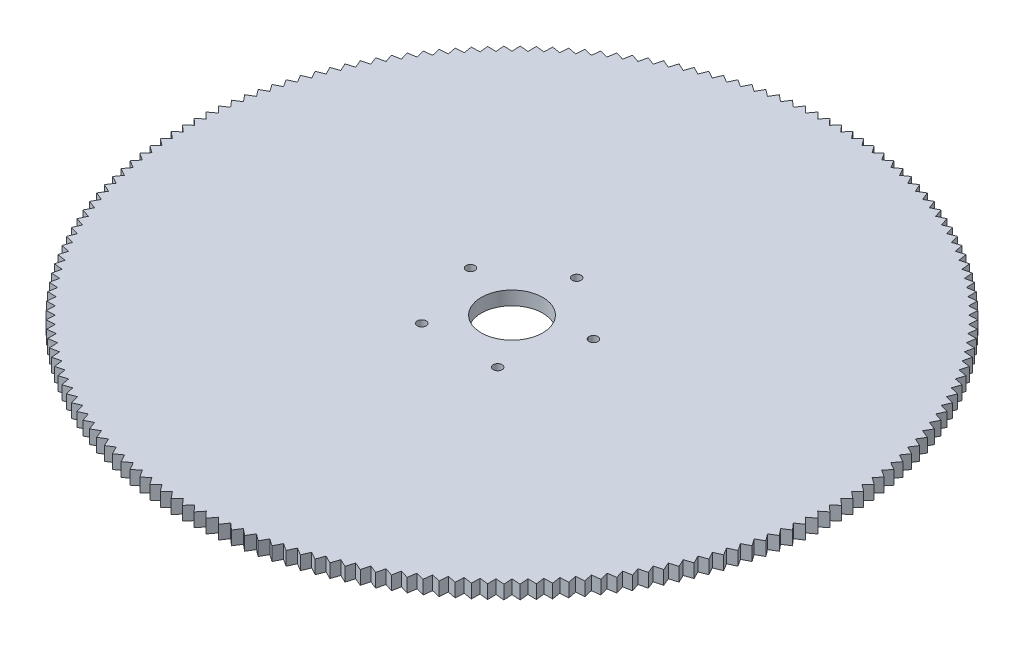
from build123d import *

# Parameters (mm, degrees)
SKETCH1_R           = 14.27
SKETCH1_R_2         = 2.05
BOSS_EXTRUDE1_DEPTH = 6.35


with BuildPart() as part:
    # Sketch1 → Boss-Extrude1 (new body)
    with BuildSketch(Plane(origin=(0, 0, 0), x_dir=(1, 0, 0), z_dir=(0, 1, 0))):
        Polygon((5.339622995, 152.906796534), (2.617860966, 149.977154273), (0, 153), (-2.617860966, 149.977154273), (-5.339622995, 152.906796534), (-7.850393436, 149.794430213), (-10.672740483, 152.62729969), (-13.073361412, 149.429204714), (-15.99285488, 152.161849991), (-18.280401511, 148.881922746), (-21.293484447, 151.511014517), (-23.465169756, 148.153251089), (-26.568171183, 150.675586211), (-28.621349306, 147.244077517), (-31.810488695, 149.656582912), (-33.742658152, 146.155509718), (-37.014050027, 148.45524612), (-38.822856765, 144.888873943), (-42.17251544, 147.073039479), (-43.855755708, 143.445713394), (-47.279600139, 145.511646993), (-48.835223169, 141.82778634), (-52.329081929, 143.77297098), (-53.755192432, 140.037063975), (-57.314808793, 141.859129749), (-58.609669273, 138.075728018), (-62.230706391, 139.772455019), (-63.392739261, 135.946168056), (-67.070785459, 137.515489084), (-68.098574961, 133.650978628), (-71.829149106, 135.090981707), (-72.721443037, 131.192956071), (-76.5, 132.501886779), (-77.255711237, 128.575095105), (-81.077647428, 129.751358712), (-81.695855252, 125.800585192), (-85.556514231, 126.842748601), (-86.036465453, 122.872806643), (-89.931143601, 123.779600139), (-90.272253473, 119.795326507), (-94.196205725, 120.565645302), (-94.398058657, 116.571894219), (-98.346504282, 117.204799797), (-98.408854349, 113.206437033), (-102.376982773, 113.701158298), (-102.299754009, 109.703055243), (-106.28273068, 110.058989452), (-106.066017178, 106.066017178), (-110.058989452, 106.28273068), (-109.703055243, 102.299754009), (-113.701158298, 102.376982773), (-113.206437033, 98.408854349), (-117.204799797, 98.346504282), (-116.571894219, 94.398058657), (-120.565645302, 94.196205725), (-119.795326507, 90.272253473), (-123.779600139, 89.931143601), (-122.872806643, 86.036465453), (-126.842748601, 85.556514231), (-125.800585192, 81.695855252), (-129.751358712, 81.077647428), (-128.575095105, 77.255711237), (-132.501886779, 76.5), (-131.192956071, 72.721443037), (-135.090981707, 71.829149106), (-133.650978628, 68.098574961), (-137.515489084, 67.070785459), (-135.946168055, 63.392739261), (-139.772455019, 62.230706391), (-138.075728018, 58.609669273), (-141.859129749, 57.314808793), (-140.037063975, 53.755192432), (-143.77297098, 52.329081929), (-141.82778634, 48.835223169), (-145.511646993, 47.279600139), (-143.445713394, 43.855755708), (-147.073039479, 42.17251544), (-144.888873943, 38.822856765), (-148.45524612, 37.014050027), (-146.155509718, 33.742658152), (-149.656582912, 31.810488695), (-147.244077517, 28.621349306), (-150.675586211, 26.568171183), (-148.153251089, 23.465169756), (-151.511014517, 21.293484447), (-148.881922746, 18.280401511), (-152.161849991, 15.99285488), (-149.429204714, 13.073361412), (-152.62729969, 10.672740483), (-149.794430213, 7.850393436), (-152.906796534, 5.339622995), (-149.977154273, 2.617860966), (-153, 0), (-149.977154273, -2.617860966), (-152.906796534, -5.339622995), (-149.794430213, -7.850393436), (-152.62729969, -10.672740483), (-149.429204714, -13.073361412), (-152.161849991, -15.99285488), (-148.881922746, -18.280401511), (-151.511014517, -21.293484447), (-148.153251089, -23.465169756), (-150.675586211, -26.568171183), (-147.244077517, -28.621349306), (-149.656582912, -31.810488695), (-146.155509718, -33.742658152), (-148.45524612, -37.014050027), (-144.888873943, -38.822856765), (-147.073039479, -42.17251544), (-143.445713394, -43.855755708), (-145.511646993, -47.279600139), (-141.82778634, -48.835223169), (-143.77297098, -52.329081929), (-140.037063975, -53.755192432), (-141.859129749, -57.314808793), (-138.075728018, -58.609669273), (-139.772455019, -62.230706391), (-135.946168055, -63.392739261), (-137.515489084, -67.070785459), (-133.650978628, -68.098574961), (-135.090981707, -71.829149106), (-131.192956071, -72.721443037), (-132.501886779, -76.5), (-128.575095105, -77.255711237), (-129.751358712, -81.077647428), (-125.800585192, -81.695855252), (-126.842748601, -85.556514231), (-122.872806643, -86.036465453), (-123.779600139, -89.931143601), (-119.795326507, -90.272253473), (-120.565645302, -94.196205725), (-116.571894219, -94.398058657), (-117.204799797, -98.346504282), (-113.206437033, -98.408854349), (-113.701158298, -102.376982773), (-109.703055243, -102.299754009), (-110.058989452, -106.28273068), (-106.066017178, -106.066017178), (-106.28273068, -110.058989452), (-102.299754009, -109.703055243), (-102.376982773, -113.701158298), (-98.408854349, -113.206437033), (-98.346504282, -117.204799797), (-94.398058657, -116.571894219), (-94.196205725, -120.565645302), (-90.272253473, -119.795326507), (-89.931143601, -123.779600139), (-86.036465453, -122.872806643), (-85.556514231, -126.842748601), (-81.695855252, -125.800585192), (-81.077647428, -129.751358712), (-77.255711237, -128.575095105), (-76.5, -132.501886779), (-72.721443037, -131.192956071), (-71.829149106, -135.090981707), (-68.098574961, -133.650978628), (-67.070785459, -137.515489084), (-63.392739261, -135.946168056), (-62.230706391, -139.772455019), (-58.609669273, -138.075728018), (-57.314808793, -141.859129749), (-53.755192432, -140.037063975), (-52.329081929, -143.77297098), (-48.835223169, -141.82778634), (-47.279600139, -145.511646993), (-43.855755708, -143.445713394), (-42.17251544, -147.073039479), (-38.822856765, -144.888873943), (-37.014050027, -148.45524612), (-33.742658152, -146.155509718), (-31.810488695, -149.656582912), (-28.621349306, -147.244077517), (-26.568171183, -150.675586211), (-23.465169756, -148.153251089), (-21.293484447, -151.511014517), (-18.280401511, -148.881922746), (-15.99285488, -152.161849991), (-13.073361412, -149.429204714), (-10.672740483, -152.62729969), (-7.850393436, -149.794430213), (-5.339622995, -152.906796534), (-2.617860966, -149.977154273), (0, -153), (2.617860966, -149.977154273), (5.339622995, -152.906796534), (7.850393436, -149.794430213), (10.672740483, -152.62729969), (13.073361412, -149.429204714), (15.99285488, -152.161849991), (18.280401511, -148.881922746), (21.293484447, -151.511014517), (23.465169756, -148.153251089), (26.568171183, -150.675586211), (28.621349306, -147.244077517), (31.810488695, -149.656582912), (33.742658152, -146.155509718), (37.014050027, -148.45524612), (38.822856765, -144.888873943), (42.17251544, -147.073039479), (43.855755708, -143.445713394), (47.279600139, -145.511646993), (48.835223169, -141.82778634), (52.329081929, -143.77297098), (53.755192432, -140.037063975), (57.314808793, -141.859129749), (58.609669273, -138.075728018), (62.230706391, -139.772455019), (63.392739261, -135.946168056), (67.070785459, -137.515489084), (68.098574961, -133.650978628), (71.829149106, -135.090981707), (72.721443037, -131.192956071), (76.5, -132.501886779), (77.255711237, -128.575095105), (81.077647428, -129.751358712), (81.695855252, -125.800585192), (85.556514231, -126.842748601), (86.036465453, -122.872806643), (89.931143601, -123.779600139), (90.272253473, -119.795326507), (94.196205725, -120.565645302), (94.398058657, -116.571894219), (98.346504282, -117.204799797), (98.408854349, -113.206437033), (102.376982773, -113.701158298), (102.299754009, -109.703055243), (106.28273068, -110.058989452), (106.066017178, -106.066017178), (110.058989452, -106.28273068), (109.703055243, -102.299754009), (113.701158298, -102.376982773), (113.206437033, -98.408854349), (117.204799797, -98.346504282), (116.571894219, -94.398058657), (120.565645302, -94.196205725), (119.795326507, -90.272253473), (123.779600139, -89.931143601), (122.872806643, -86.036465453), (126.842748601, -85.556514231), (125.800585192, -81.695855252), (129.751358712, -81.077647428), (128.575095105, -77.255711237), (132.501886779, -76.5), (131.192956071, -72.721443037), (135.090981707, -71.829149106), (133.650978628, -68.098574961), (137.515489084, -67.070785459), (135.946168056, -63.392739261), (139.772455019, -62.230706391), (138.075728018, -58.609669273), (141.859129749, -57.314808793), (140.037063975, -53.755192432), (143.77297098, -52.329081929), (141.82778634, -48.835223169), (145.511646993, -47.279600139), (143.445713394, -43.855755708), (147.073039479, -42.17251544), (144.888873943, -38.822856765), (148.45524612, -37.014050027), (146.155509718, -33.742658152), (149.656582912, -31.810488695), (147.244077517, -28.621349306), (150.675586211, -26.568171183), (148.153251089, -23.465169756), (151.511014517, -21.293484447), (148.881922746, -18.280401511), (152.161849991, -15.99285488), (149.429204714, -13.073361412), (152.62729969, -10.672740483), (149.794430213, -7.850393436), (152.906796534, -5.339622995), (149.977154273, -2.617860966), (153, 0), (149.977154273, 2.617860966), (152.906796534, 5.339622995), (149.794430213, 7.850393436), (152.62729969, 10.672740483), (149.429204714, 13.073361412), (152.161849991, 15.99285488), (148.881922746, 18.280401511), (151.511014517, 21.293484447), (148.153251089, 23.465169756), (150.675586211, 26.568171183), (147.244077517, 28.621349306), (149.656582912, 31.810488695), (146.155509718, 33.742658152), (148.45524612, 37.014050027), (144.888873943, 38.822856765), (147.073039479, 42.17251544), (143.445713394, 43.855755708), (145.511646993, 47.279600139), (141.82778634, 48.835223169), (143.77297098, 52.329081929), (140.037063975, 53.755192432), (141.859129749, 57.314808793), (138.075728018, 58.609669273), (139.772455019, 62.230706391), (135.946168056, 63.392739261), (137.515489084, 67.070785459), (133.650978628, 68.098574961), (135.090981707, 71.829149106), (131.192956071, 72.721443037), (132.501886779, 76.5), (128.575095105, 77.255711237), (129.751358712, 81.077647428), (125.800585192, 81.695855252), (126.842748601, 85.556514231), (122.872806643, 86.036465453), (123.779600139, 89.931143601), (119.795326507, 90.272253473), (120.565645302, 94.196205725), (116.571894219, 94.398058657), (117.204799797, 98.346504282), (113.206437033, 98.408854349), (113.701158298, 102.376982773), (109.703055243, 102.299754009), (110.058989452, 106.28273068), (106.066017178, 106.066017178), (106.28273068, 110.058989452), (102.299754009, 109.703055243), (102.376982773, 113.701158298), (98.408854349, 113.206437033), (98.346504282, 117.204799797), (94.398058657, 116.571894219), (94.196205725, 120.565645302), (90.272253473, 119.795326507), (89.931143601, 123.779600139), (86.036465453, 122.872806643), (85.556514231, 126.842748601), (81.695855252, 125.800585192), (81.077647428, 129.751358712), (77.255711237, 128.575095105), (76.5, 132.501886779), (72.721443037, 131.192956071), (71.829149106, 135.090981707), (68.098574961, 133.650978628), (67.070785459, 137.515489084), (63.392739261, 135.946168056), (62.230706391, 139.772455019), (58.609669273, 138.075728018), (57.314808793, 141.859129749), (53.755192432, 140.037063975), (52.329081929, 143.77297098), (48.835223169, 141.82778634), (47.279600139, 145.511646993), (43.855755708, 143.445713394), (42.17251544, 147.073039479), (38.822856765, 144.888873943), (37.014050027, 148.45524612), (33.742658152, 146.155509718), (31.810488695, 149.656582912), (28.621349306, 147.244077517), (26.568171183, 150.675586211), (23.465169756, 148.153251089), (21.293484447, 151.511014517), (18.280401511, 148.881922746), (15.99285488, 152.161849991), (13.073361412, 149.429204714), (10.672740483, 152.62729969), (7.850393436, 149.794430213), align=None)
        with Locations(Location((0, 0, 0), (0, 0, 270))):
            Circle(SKETCH1_R, mode=Mode.SUBTRACT)
        with Locations(Location((0, 30, 0), (0, 0, 270))):
            Circle(SKETCH1_R_2, mode=Mode.SUBTRACT)
        with Locations(Location((28.531695489, 9.270509831, 0), (0, 0, 270))):
            Circle(SKETCH1_R_2, mode=Mode.SUBTRACT)
        with Locations(Location((17.633557569, -24.270509831, 0), (0, 0, 270))):
            Circle(SKETCH1_R_2, mode=Mode.SUBTRACT)
        with Locations(Location((-17.633557569, -24.270509831, 0), (0, 0, 270))):
            Circle(SKETCH1_R_2, mode=Mode.SUBTRACT)
        with Locations(Location((-28.531695489, 9.270509831, 0), (0, 0, 270))):
            Circle(SKETCH1_R_2, mode=Mode.SUBTRACT)
    extrude(amount=BOSS_EXTRUDE1_DEPTH)


solid = part.part
